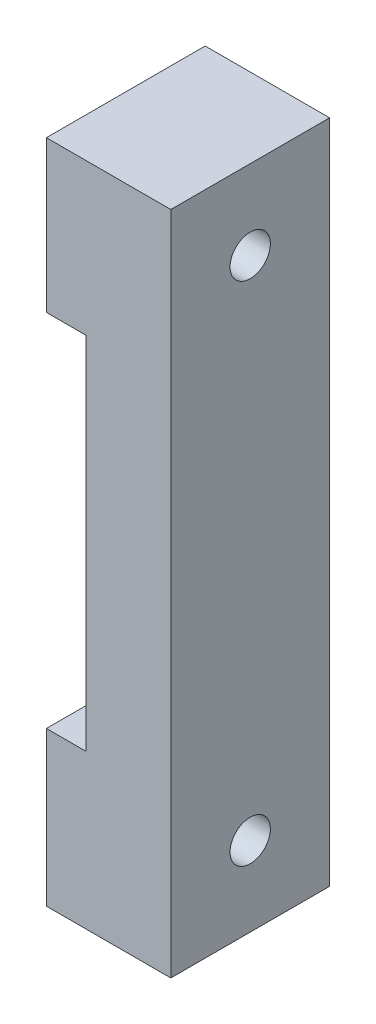
from build123d import *

# Parameters (mm, degrees)
BOSS_EXTRUDE1_DEPTH = 25
SKETCH2_R           = 3.175
CUT_EXTRUDE1_DEPTH  = 40


with BuildPart() as part:
    # Sketch1 → Boss-Extrude1 (new body)
    with BuildSketch(Plane.XY):
        Polygon((0, 0), (19.584, 0), (19.584, 104.78), (0, 104.78), (0, 80.95), (6.27, 80.95), (6.27, 24.23), (0, 24.23), align=None)
    extrude(amount=BOSS_EXTRUDE1_DEPTH)

    # Sketch2 → Cut-Extrude1 (cut)
    with BuildSketch(Plane(origin=(0, 0, 0), x_dir=(0, 0, -1), z_dir=(1, 0, 0))):
        with Locations(Location((-12.5, 92.28, 0), (0, 0, 270))):
            Circle(SKETCH2_R)
        with Locations(Location((-12.5, 12.5, 0), (0, 0, 270))):
            Circle(SKETCH2_R)
    extrude(amount=CUT_EXTRUDE1_DEPTH, mode=Mode.SUBTRACT)


solid = part.part
